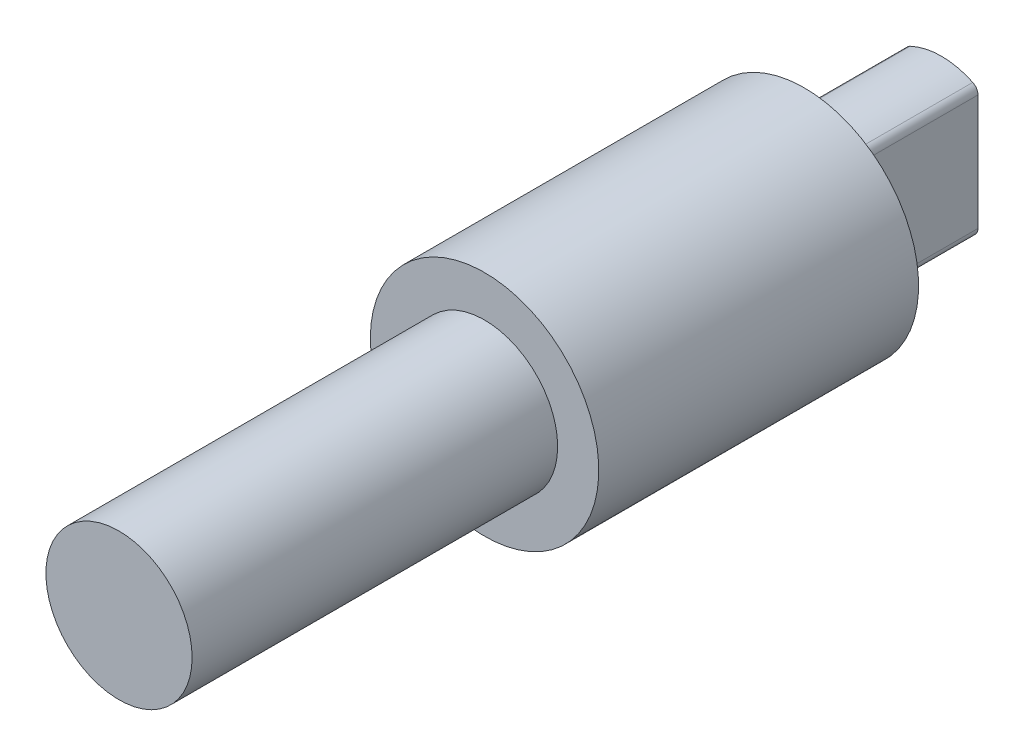
from build123d import *

# Parameters (mm, degrees)
CUT_EXTRUDE2_START  = -30
CUT_EXTRUDE2_DEPTH  = 30
SKETCH6_R           = 8
BOSS_EXTRUDE1_DEPTH = 10
CUT_EXTRUDE3_DEPTH  = 15
FILLET1_R           = 1
SKETCH8_R           = 2.5
CUT_EXTRUDE4_DEPTH  = 1


with BuildPart() as part:
    # Sketch2 → Revolve2 (revolve)
    with BuildSketch(Plane(origin=(0, 0, 0), x_dir=(1, 0, 0), z_dir=(0, 1, 0)), mode=Mode.PRIVATE) as revolve2_sk:
        Polygon((0, -40), (8, -40), (8, -10), (12.5, -10), (12.5, 25), (8, 25), (8, 40), (0, 40), align=None)
    revolve(revolve2_sk.sketch.rotate(Axis((0, 0, -364.100348117), (0, 0, 1)), 180), axis=Axis((0, 0, -364.100348117), (0, 0, 1)))

    # Sketch4 → Cut-Extrude2 (cut)
    with BuildSketch(Plane.XY.offset(40).offset(CUT_EXTRUDE2_START)):
        with BuildLine():
            Line((-6.61, 1.39), (-7.878318348, 1.39))
            ThreePointArc((-7.878318348, 1.39), (-8, 0), (-7.878318348, -1.39))
            Line((-7.878318348, -1.39), (-6.61, -1.39))
            Line((-6.61, -1.39), (-6.61, 1.39))
        make_face()
    extrude(amount=CUT_EXTRUDE2_DEPTH, mode=Mode.SUBTRACT)

    # Sketch6 → Boss-Extrude1 (add)
    with BuildSketch(Plane.XY.offset(40)):
        with Locations(Location((0, 0, 0), (0, 0, 190.005924043))):
            Circle(SKETCH6_R)
    extrude(amount=BOSS_EXTRUDE1_DEPTH)

    # Sketch7 → Cut-Extrude3 (cut)
    with BuildSketch(Plane(origin=(0, 0, -40), x_dir=(-1, 0, 0), z_dir=(0, 0, -1))):
        with BuildLine():
            Line((-4, 6.92820323), (-4, -6.92820323))
            ThreePointArc((-4, -6.92820323), (-8, 0), (-4, 6.92820323))
        make_face()
        with BuildLine():
            Line((4, 6.92820323), (4, -6.92820323))
            ThreePointArc((4, -6.92820323), (8, 0), (4, 6.92820323))
        make_face()
    extrude(amount=-CUT_EXTRUDE3_DEPTH, mode=Mode.SUBTRACT)

    # Fillet1
    fillet1_edges = [part.edges().sort_by_distance(p)[0] for p in [
        (4, 6.92820323, -32.5),
        (4, -6.92820323, -32.5),
        (-4, -6.92820323, -32.5),
        (-4, 6.92820323, -32.5),
    ]]
    fillet(fillet1_edges, radius=FILLET1_R)

    # Sketch8 → Cut-Extrude4 (cut)
    with BuildSketch(Plane.ZY.offset(4)):
        with Locations((-32.5, 0)):
            Circle(SKETCH8_R)
    extrude(amount=-CUT_EXTRUDE4_DEPTH, mode=Mode.SUBTRACT)


solid = part.part
